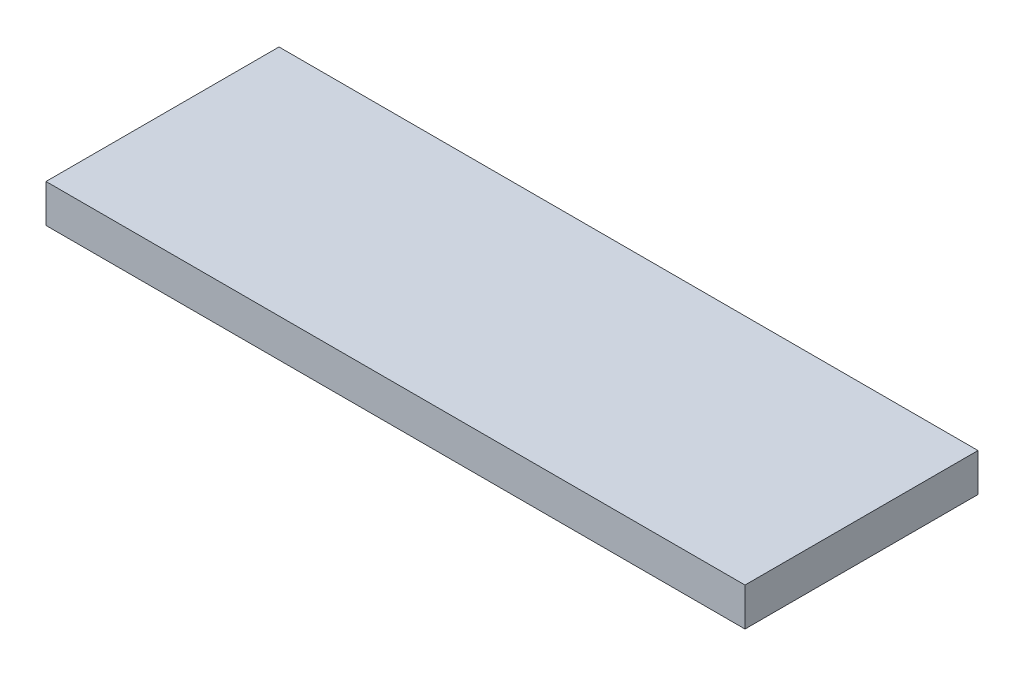
from build123d import *

# Parameters (mm, degrees)
SZKIC1_W                    = 165
SZKIC1_H                    = 55
DODANIE_WYCI_GNI_CIE1_DEPTH = 9


with BuildPart() as part:
    # Szkic1 → Dodanie-wyciągnięcie1 (new body)
    with BuildSketch(Plane(origin=(0, 0, 0), x_dir=(1, 0, 0), z_dir=(0, 1, 0))):
        Rectangle(SZKIC1_W, SZKIC1_H)
    extrude(amount=DODANIE_WYCI_GNI_CIE1_DEPTH)


solid = part.part
